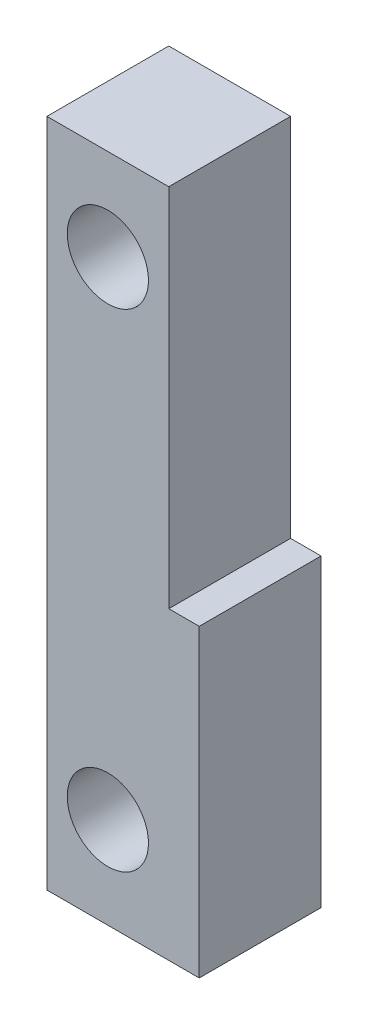
from build123d import *

# Parameters (mm, degrees)
SKETCH1_W           = 6
SKETCH1_H           = 6
BOSS_EXTRUDE1_DEPTH = 33
SKETCH2_R           = 2
CUT_EXTRUDE1_DEPTH  = 33
SKETCH3_W           = 6
SKETCH3_H           = 15
BOSS_EXTRUDE2_DEPTH = 1.5


with BuildPart() as part:
    # Sketch1 → Boss-Extrude1 (new body)
    with BuildSketch(Plane(origin=(0, 0, 0), x_dir=(1, 0, 0), z_dir=(0, 1, 0))):
        Rectangle(SKETCH1_W, SKETCH1_H)
    extrude(amount=BOSS_EXTRUDE1_DEPTH)

    # Sketch2 → Cut-Extrude1 (cut)
    with BuildSketch(Plane.XY.offset(3)):
        with Locations((0, 28.5)):
            Circle(SKETCH2_R)
        with Locations((0, 4.5)):
            Circle(SKETCH2_R)
    extrude(amount=-CUT_EXTRUDE1_DEPTH, mode=Mode.SUBTRACT)

    # Sketch3 → Boss-Extrude2 (add)
    with BuildSketch(Plane(origin=(3, 0, 0), x_dir=(0, 0, -1), z_dir=(1, 0, 0))):
        with Locations((0, 7.5)):
            Rectangle(SKETCH3_W, SKETCH3_H)
    extrude(amount=BOSS_EXTRUDE2_DEPTH)


solid = part.part
